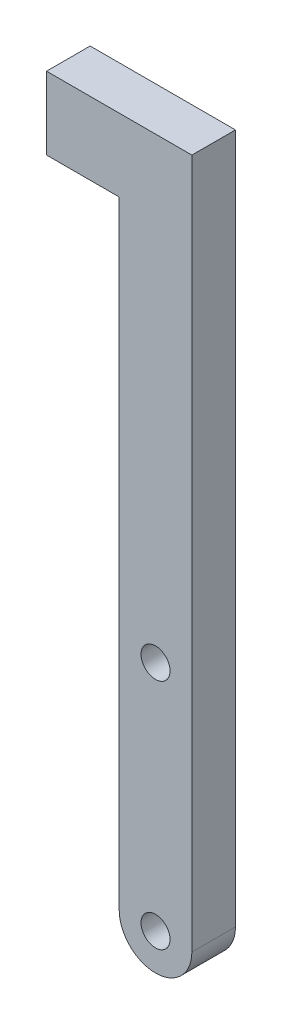
from build123d import *

# Parameters (mm, degrees)
BOSS_EXTRU_1_DEPTH      = 3
ESQUISSE3_R             = 1
ENL_V_MAT_EXTRU_1_DEPTH = 4
ESQUISSE4_R             = 1
ENL_V_MAT_EXTRU_2_DEPTH = 10


with BuildPart() as part:
    # Esquisse1 → Boss.-Extru.1 (new body)
    with BuildSketch(Plane.XY):
        with BuildLine():
            Line((0, 0), (10, 0))
            Line((10, 0), (10, -47.5))
            ThreePointArc((10, -47.5), (7.5, -50), (5, -47.5))
            Line((5, -47.5), (5, -5))
            Line((5, -5), (0, -5))
            Line((0, -5), (0, 0))
        make_face()
    extrude(amount=BOSS_EXTRU_1_DEPTH)

    # Esquisse3 → Enlèv. mat.-Extru.1 (cut)
    with BuildSketch(Plane(origin=(0, 0, 0), x_dir=(-1, 0, 0), z_dir=(0, 0, -1))):
        with Locations((-7.5, -47.5)):
            Circle(ESQUISSE3_R)
    extrude(amount=-ENL_V_MAT_EXTRU_1_DEPTH, mode=Mode.SUBTRACT)

    # Esquisse4 → Enlèv. mat.-Extru.2 (cut)
    with BuildSketch(Plane.XY.offset(3)):
        with Locations((7.5, -31.5)):
            Circle(ESQUISSE4_R)
    extrude(amount=-ENL_V_MAT_EXTRU_2_DEPTH, mode=Mode.SUBTRACT)


solid = part.part
